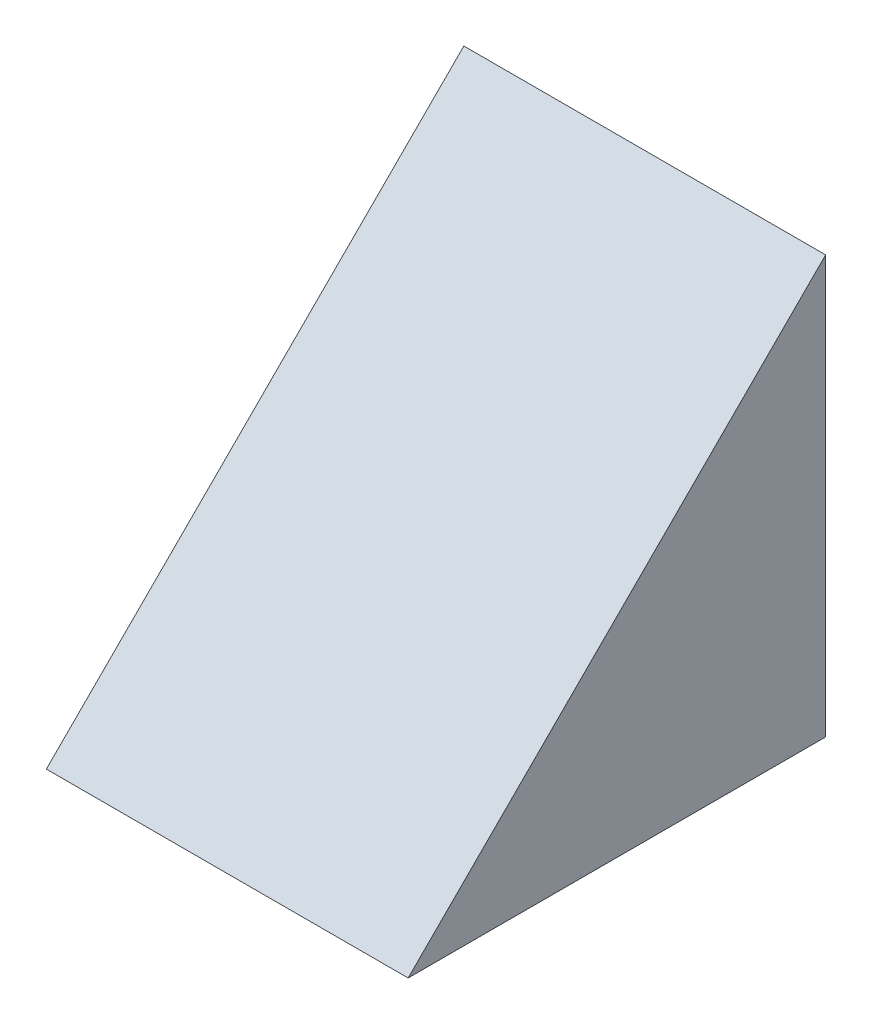
from build123d import *

# Parameters (mm, degrees)
BOSS_EXTRUDE2_DEPTH = 26


with BuildPart() as part:
    # Sketch2 → Boss-Extrude2 (new body)
    with BuildSketch(Plane(origin=(-5.957962043, 0, 0), x_dir=(0, 0, -1), z_dir=(1, 0, 0))):
        Polygon((-7.302957559, -51.905150875), (-7.302957559, -21.905150875), (-37.302957559, -51.905150875), align=None)
    extrude(amount=-BOSS_EXTRUDE2_DEPTH)


solid = part.part
